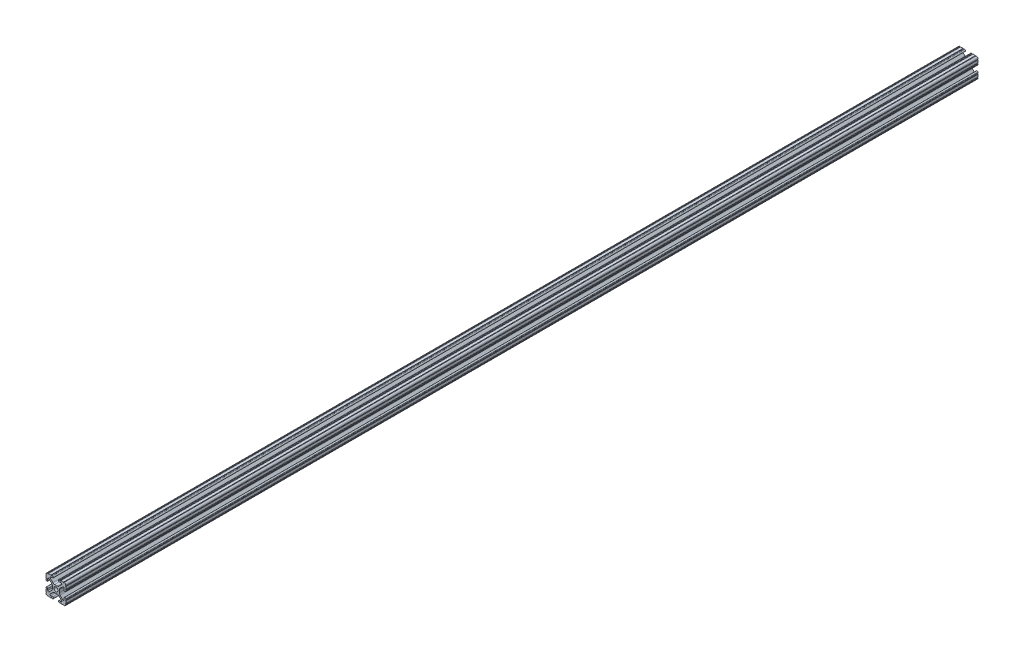
from build123d import *

# Parameters (mm, degrees)
SKETCH1_R           = 2.6035
BOSS_EXTRUDE1_DEPTH = 1168.4


with BuildPart() as part:
    # Sketch1 → Boss-Extrude1 (new body)
    with BuildSketch(Plane(origin=(0, 0, -2463.8), x_dir=(-1, 0, 0), z_dir=(0, 0, -1))):
        with BuildLine():
            Line((12.7, -9.5504), (12.7, -6.3330836))
            ThreePointArc((12.7, -6.3330836), (12.192, -5.8250836), (12.7, -5.3170836))
            Line((12.7, -5.3170836), (12.7, -4.3434))
            ThreePointArc((12.7, -4.3434), (11.5951, -3.2385), (10.4902, -4.3434))
            Line((10.4902, -4.3434), (10.4902, -6.474794456))
            ThreePointArc((10.4902, -6.474794456), (9.863006367, -7.413456061), (8.75577951, -7.193214945))
            Line((8.75577951, -7.193214945), (5.42573597, -3.863171405))
            ThreePointArc((5.42573597, -3.863171405), (4.737482484, -2.833127272), (4.4958, -1.618107374))
            Line((4.4958, -1.618107374), (4.4958, 1.618107374))
            ThreePointArc((4.4958, 1.618107374), (4.737482484, 2.833127272), (5.42573597, 3.863171405))
            Line((5.42573597, 3.863171405), (8.75577951, 7.193214945))
            ThreePointArc((8.75577951, 7.193214945), (9.863006367, 7.413456061), (10.4902, 6.474794456))
            Line((10.4902, 6.474794456), (10.4902, 4.343399971))
            ThreePointArc((10.4902, 4.343399971), (11.5951, 3.238499971), (12.7, 4.343399971))
            Line((12.7, 4.343399971), (12.7, 5.3170836))
            ThreePointArc((12.7, 5.3170836), (12.192, 5.8250836), (12.7, 6.3330836))
            Line((12.7, 6.3330836), (12.7, 9.5504))
            ThreePointArc((12.7, 9.5504), (12.192000006, 10.058323491), (12.699846982, 10.566399977))
            ThreePointArc((12.699846982, 10.566399977), (12.082522516, 12.082522516), (10.566399977, 12.699846982))
            ThreePointArc((10.566399977, 12.699846982), (10.058323491, 12.192000006), (9.5504, 12.7))
            Line((9.5504, 12.7), (6.3330836, 12.7))
            ThreePointArc((6.3330836, 12.7), (5.8250836, 12.192), (5.3170836, 12.7))
            Line((5.3170836, 12.7), (4.3434, 12.7))
            ThreePointArc((4.3434, 12.7), (3.2385, 11.5951), (4.3434, 10.4902))
            Line((4.3434, 10.4902), (6.474794456, 10.4902))
            ThreePointArc((6.474794456, 10.4902), (7.413456061, 9.863006367), (7.193214945, 8.75577951))
            Line((7.193214945, 8.75577951), (3.863171405, 5.42573597))
            ThreePointArc((3.863171405, 5.42573597), (2.833127272, 4.737482484), (1.618107374, 4.4958))
            Line((1.618107374, 4.4958), (-1.618107374, 4.4958))
            ThreePointArc((-1.618107374, 4.4958), (-2.833127272, 4.737482484), (-3.863171405, 5.42573597))
            Line((-3.863171405, 5.42573597), (-7.193214945, 8.75577951))
            ThreePointArc((-7.193214945, 8.75577951), (-7.413456061, 9.863006367), (-6.474794456, 10.4902))
            Line((-6.474794456, 10.4902), (-4.343399971, 10.4902))
            ThreePointArc((-4.343399971, 10.4902), (-3.238499971, 11.5951), (-4.343399971, 12.7))
            Line((-4.343399971, 12.7), (-5.3170836, 12.7))
            ThreePointArc((-5.3170836, 12.7), (-5.8250836, 12.192), (-6.3330836, 12.7))
            Line((-6.3330836, 12.7), (-9.5504, 12.7))
            ThreePointArc((-9.5504, 12.7), (-10.058323491, 12.192000006), (-10.566399977, 12.699846982))
            ThreePointArc((-10.566399977, 12.699846982), (-12.082522516, 12.082522516), (-12.699846982, 10.566399977))
            ThreePointArc((-12.699846982, 10.566399977), (-12.192000006, 10.058323491), (-12.7, 9.5504))
            Line((-12.7, 9.5504), (-12.7, 6.3330836))
            ThreePointArc((-12.7, 6.3330836), (-12.192, 5.8250836), (-12.7, 5.3170836))
            Line((-12.7, 5.3170836), (-12.7, 4.3434))
            ThreePointArc((-12.7, 4.3434), (-11.5951, 3.2385), (-10.4902, 4.3434))
            Line((-10.4902, 4.3434), (-10.4902, 6.474794456))
            ThreePointArc((-10.4902, 6.474794456), (-9.863006367, 7.413456061), (-8.75577951, 7.193214945))
            Line((-8.75577951, 7.193214945), (-5.42573597, 3.863171405))
            ThreePointArc((-5.42573597, 3.863171405), (-4.737482484, 2.833127272), (-4.4958, 1.618107374))
            Line((-4.4958, 1.618107374), (-4.4958, -1.618107374))
            ThreePointArc((-4.4958, -1.618107374), (-4.737482484, -2.833127272), (-5.42573597, -3.863171405))
            Line((-5.42573597, -3.863171405), (-8.75577951, -7.193214945))
            ThreePointArc((-8.75577951, -7.193214945), (-9.863006367, -7.413456061), (-10.4902, -6.474794456))
            Line((-10.4902, -6.474794456), (-10.4902, -4.343399971))
            ThreePointArc((-10.4902, -4.343399971), (-11.5951, -3.238499971), (-12.7, -4.343399971))
            Line((-12.7, -4.343399971), (-12.7, -5.3170836))
            ThreePointArc((-12.7, -5.3170836), (-12.192, -5.8250836), (-12.7, -6.3330836))
            Line((-12.7, -6.3330836), (-12.7, -9.5504))
            ThreePointArc((-12.7, -9.5504), (-12.192000006, -10.058323491), (-12.699846982, -10.566399977))
            ThreePointArc((-12.699846982, -10.566399977), (-12.082522516, -12.082522516), (-10.566399977, -12.699846982))
            ThreePointArc((-10.566399977, -12.699846982), (-10.058323491, -12.192000006), (-9.5504, -12.7))
            Line((-9.5504, -12.7), (-6.3330836, -12.7))
            ThreePointArc((-6.3330836, -12.7), (-5.8250836, -12.192), (-5.3170836, -12.7))
            Line((-5.3170836, -12.7), (-4.3434, -12.7))
            ThreePointArc((-4.3434, -12.7), (-3.2385, -11.5951), (-4.3434, -10.4902))
            Line((-4.3434, -10.4902), (-6.474794456, -10.4902))
            ThreePointArc((-6.474794456, -10.4902), (-7.413456061, -9.863006367), (-7.193214945, -8.75577951))
            Line((-7.193214945, -8.75577951), (-3.863171405, -5.42573597))
            ThreePointArc((-3.863171405, -5.42573597), (-2.833127272, -4.737482484), (-1.618107374, -4.4958))
            Line((-1.618107374, -4.4958), (1.618107374, -4.4958))
            ThreePointArc((1.618107374, -4.4958), (2.833127272, -4.737482484), (3.863171405, -5.42573597))
            Line((3.863171405, -5.42573597), (7.193214945, -8.75577951))
            ThreePointArc((7.193214945, -8.75577951), (7.413456061, -9.863006367), (6.474794456, -10.4902))
            Line((6.474794456, -10.4902), (4.343399971, -10.4902))
            ThreePointArc((4.343399971, -10.4902), (3.238499971, -11.5951), (4.343399971, -12.7))
            Line((4.343399971, -12.7), (5.3170836, -12.7))
            ThreePointArc((5.3170836, -12.7), (5.8250836, -12.192), (6.3330836, -12.7))
            Line((6.3330836, -12.7), (9.5504, -12.7))
            ThreePointArc((9.5504, -12.7), (10.058323491, -12.192000006), (10.566399977, -12.699846982))
            ThreePointArc((10.566399977, -12.699846982), (12.082522516, -12.082522516), (12.699846982, -10.566399977))
            ThreePointArc((12.699846982, -10.566399977), (12.192000006, -10.058323491), (12.7, -9.5504))
        make_face()
        with Locations(Location((0, 0, 0), (0, 0, 180))):
            Circle(SKETCH1_R, mode=Mode.SUBTRACT)
    extrude(amount=BOSS_EXTRUDE1_DEPTH)


solid = part.part
